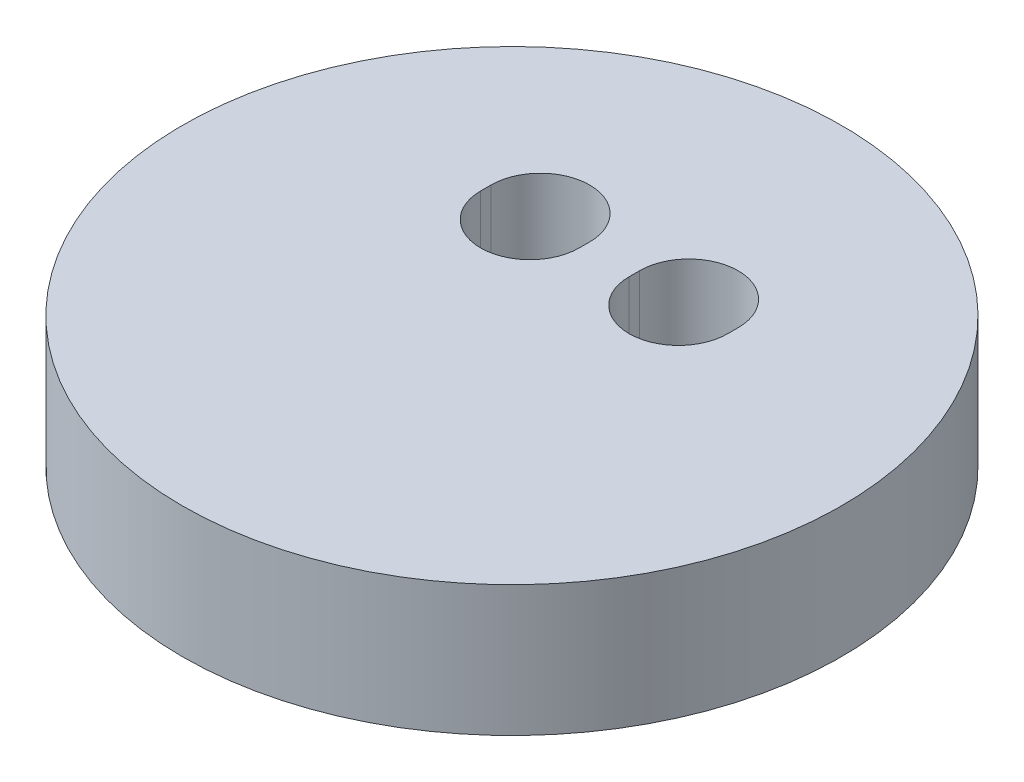
from build123d import *

# Parameters (mm, degrees)
SKETCH1_R           = 12.36
BOSS_EXTRUDE1_DEPTH = 4.9
CUT_EXTRUDE1_DEPTH  = 19.153490023


with BuildPart() as part:
    # Sketch1 → Boss-Extrude1 (new body)
    with BuildSketch(Plane(origin=(0, 0, 0), x_dir=(1, 0, 0), z_dir=(0, 1, 0))):
        with Locations(Location((0, 0, 0), (0, 0, 270))):
            Circle(SKETCH1_R)
    extrude(amount=BOSS_EXTRUDE1_DEPTH)

    # Sketch2 → Cut-Extrude1 (cut, through all)
    with BuildSketch(Plane(origin=(0, 4.9, 0), x_dir=(1, 0, 0), z_dir=(0, 1, 0))):
        with BuildLine():
            Line((4.635, 3.85), (4.635, 3.46))
            ThreePointArc((4.635, 3.46), (2.785, 1.61), (0.935, 3.46))
            Line((0.935, 3.46), (0.935, 3.85))
            ThreePointArc((0.935, 3.85), (2.785, 5.7), (4.635, 3.85))
        make_face()
        with BuildLine():
            Line((-0.935, 3.85), (-0.935, 3.46))
            ThreePointArc((-0.935, 3.46), (-2.785, 1.61), (-4.635, 3.46))
            Line((-4.635, 3.46), (-4.635, 3.85))
            ThreePointArc((-4.635, 3.85), (-2.785, 5.7), (-0.935, 3.85))
        make_face()
    extrude(amount=-CUT_EXTRUDE1_DEPTH, mode=Mode.SUBTRACT)


solid = part.part
